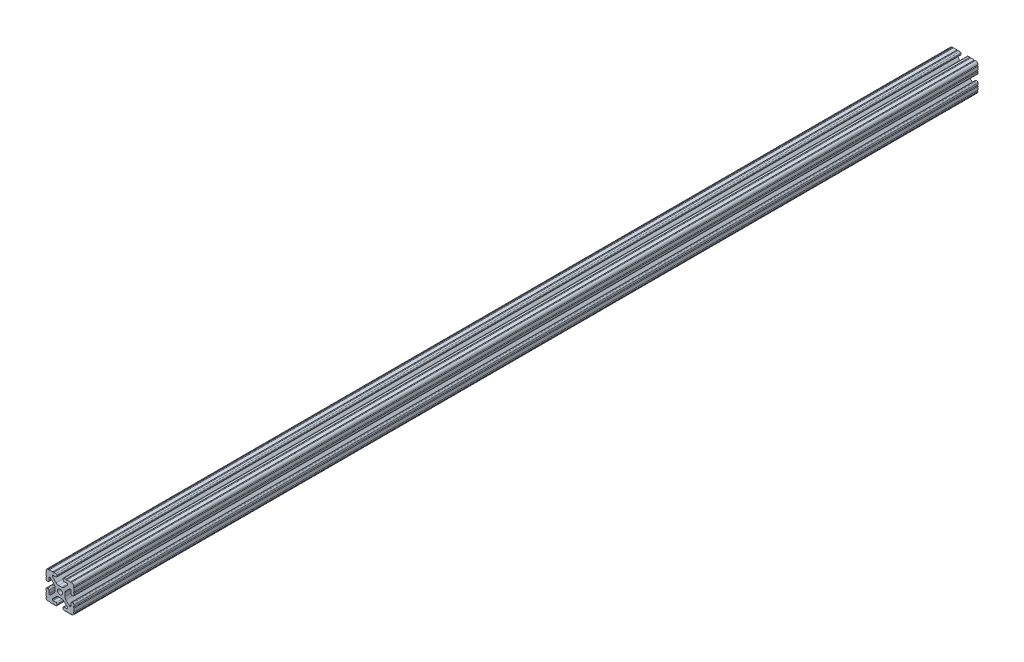
from build123d import *

# Parameters (mm, degrees)
SKETCH1_R      = 3.3274
EXTRUDE1_DEPTH = 1231.9


with BuildPart() as part:
    # Sketch1 → Extrude1 (new body)
    with BuildSketch(Plane.XY):
        with BuildLine():
            Line((-10.022898969, 12.91475973), (-5.252158105, 8.144007132))
            ThreePointArc((-5.252158105, 8.144007132), (-3.715177372, 7.117027388), (-1.902183975, 6.7564))
            Line((-1.902183975, 6.7564), (1.902183975, 6.7564))
            ThreePointArc((1.902183975, 6.7564), (3.715177372, 7.117027388), (5.252158105, 8.144007132))
            Line((5.252158105, 8.144007132), (10.022898969, 12.91475973))
            ThreePointArc((10.022898969, 12.91475973), (10.218362387, 13.207291992), (10.287, 13.552357131))
            Line((10.287, 13.552357131), (10.287, 14.0843))
            ThreePointArc((10.287, 14.0843), (10.022898185, 14.721898185), (9.3853, 14.986))
            Line((9.3853, 14.986), (5.617617549, 14.986))
            ThreePointArc((5.617617549, 14.986), (4.519044045, 15.441044045), (4.064, 16.539617549))
            Line((4.064, 16.539617549), (4.064, 17.496382451))
            ThreePointArc((4.064, 17.496382451), (4.519044045, 18.594955955), (5.617617549, 19.05))
            Line((5.617617549, 19.05), (7.974178704, 19.05))
            ThreePointArc((7.974178704, 19.05), (8.736178704, 18.288), (9.498178704, 19.05))
            Line((9.498178704, 19.05), (14.327719207, 19.05))
            ThreePointArc((14.327719207, 19.05), (15.087603123, 18.231251131), (15.847487039, 19.05))
            ThreePointArc((15.847487039, 19.05), (18.120176289, 18.120192083), (19.05, 15.847509295))
            ThreePointArc((19.05, 15.847509295), (18.231250992, 15.08762539), (19.05, 14.327741484))
            Line((19.05, 14.327741484), (19.05, 9.496091471))
            ThreePointArc((19.05, 9.496091471), (18.231250992, 8.736207565), (19.05, 7.97632366))
            Line((19.05, 7.97632366), (19.05, 5.617617549))
            ThreePointArc((19.05, 5.617617549), (18.594955955, 4.519044045), (17.496382451, 4.064))
            Line((17.496382451, 4.064), (16.539617549, 4.064))
            ThreePointArc((16.539617549, 4.064), (15.441044045, 4.519044045), (14.986, 5.617617549))
            Line((14.986, 5.617617549), (14.986, 9.385342516))
            ThreePointArc((14.986, 9.385342516), (14.721898185, 10.022940701), (14.0843, 10.287042516))
            Line((14.0843, 10.287042516), (13.516042086, 10.287042516))
            ThreePointArc((13.516042086, 10.287042516), (13.170975923, 10.218404478), (12.878443117, 10.022939917))
            Line((12.878443117, 10.022939917), (8.14758008, 5.292065243))
            ThreePointArc((8.14758008, 5.292065243), (7.117955879, 3.751120653), (6.7564, 1.933453584))
            Line((6.7564, 1.933453584), (6.7564, -1.933453584))
            ThreePointArc((6.7564, -1.933453584), (7.117955879, -3.751120653), (8.14758008, -5.292065243))
            Line((8.14758008, -5.292065243), (12.878443117, -10.022939917))
            ThreePointArc((12.878443117, -10.022939917), (13.170975923, -10.218404478), (13.516042086, -10.287042516))
            Line((13.516042086, -10.287042516), (14.0843, -10.287042516))
            ThreePointArc((14.0843, -10.287042516), (14.721898185, -10.022940701), (14.986, -9.385342516))
            Line((14.986, -9.385342516), (14.986, -5.617617549))
            ThreePointArc((14.986, -5.617617549), (15.441044045, -4.519044045), (16.539617549, -4.064))
            Line((16.539617549, -4.064), (17.496382451, -4.064))
            ThreePointArc((17.496382451, -4.064), (18.594955955, -4.519044045), (19.05, -5.617617549))
            Line((19.05, -5.617617549), (19.05, -7.976318491))
            ThreePointArc((19.05, -7.976318491), (18.231250992, -8.736202396), (19.05, -9.496086302))
            Line((19.05, -9.496086302), (19.05, -14.32774291))
            ThreePointArc((19.05, -14.32774291), (18.231250992, -15.087626816), (19.05, -15.847510721))
            ThreePointArc((19.05, -15.847510721), (18.120175716, -18.120192644), (15.847486868, -19.05))
            ThreePointArc((15.847486868, -19.05), (15.087602952, -18.231251131), (14.327719036, -19.05))
            Line((14.327719036, -19.05), (9.496062448, -19.05))
            ThreePointArc((9.496062448, -19.05), (8.736178532, -18.231251131), (7.976294616, -19.05))
            Line((7.976294616, -19.05), (5.617617549, -19.05))
            ThreePointArc((5.617617549, -19.05), (4.519044045, -18.594955955), (4.064, -17.496382451))
            Line((4.064, -17.496382451), (4.064, -16.539617549))
            ThreePointArc((4.064, -16.539617549), (4.519044045, -15.441044045), (5.617617549, -14.986))
            Line((5.617617549, -14.986), (9.3853, -14.986))
            ThreePointArc((9.3853, -14.986), (10.022898185, -14.721898185), (10.287, -14.0843))
            Line((10.287, -14.0843), (10.287, -13.552357131))
            ThreePointArc((10.287, -13.552357131), (10.218362387, -13.207291992), (10.022898969, -12.91475973))
            Line((10.022898969, -12.91475973), (5.252158105, -8.144007132))
            ThreePointArc((5.252158105, -8.144007132), (3.715177372, -7.117027388), (1.902183975, -6.7564))
            Line((1.902183975, -6.7564), (-1.902183975, -6.7564))
            ThreePointArc((-1.902183975, -6.7564), (-3.715177372, -7.117027388), (-5.252158105, -8.144007132))
            Line((-5.252158105, -8.144007132), (-10.022898969, -12.91475973))
            ThreePointArc((-10.022898969, -12.91475973), (-10.218362387, -13.207291992), (-10.287, -13.552357131))
            Line((-10.287, -13.552357131), (-10.287, -14.0843))
            ThreePointArc((-10.287, -14.0843), (-10.022898185, -14.721898185), (-9.3853, -14.986))
            Line((-9.3853, -14.986), (-5.617617549, -14.986))
            ThreePointArc((-5.617617549, -14.986), (-4.519044045, -15.441044045), (-4.064, -16.539617549))
            Line((-4.064, -16.539617549), (-4.064, -17.496382451))
            ThreePointArc((-4.064, -17.496382451), (-4.519044045, -18.594955955), (-5.617617549, -19.05))
            Line((-5.617617549, -19.05), (-7.976294616, -19.05))
            ThreePointArc((-7.976294616, -19.05), (-8.736178532, -18.231251131), (-9.496062448, -19.05))
            Line((-9.496062448, -19.05), (-14.327719036, -19.05))
            ThreePointArc((-14.327719036, -19.05), (-15.087602952, -18.231251131), (-15.847486868, -19.05))
            ThreePointArc((-15.847486868, -19.05), (-18.120175716, -18.120192644), (-19.05, -15.847510721))
            ThreePointArc((-19.05, -15.847510721), (-18.231250992, -15.087626816), (-19.05, -14.32774291))
            Line((-19.05, -14.32774291), (-19.05, -9.496086302))
            ThreePointArc((-19.05, -9.496086302), (-18.231250992, -8.736202396), (-19.05, -7.976318491))
            Line((-19.05, -7.976318491), (-19.05, -5.617617549))
            ThreePointArc((-19.05, -5.617617549), (-18.594955955, -4.519044045), (-17.496382451, -4.064))
            Line((-17.496382451, -4.064), (-16.539617549, -4.064))
            ThreePointArc((-16.539617549, -4.064), (-15.441044045, -4.519044045), (-14.986, -5.617617549))
            Line((-14.986, -5.617617549), (-14.986, -9.385342516))
            ThreePointArc((-14.986, -9.385342516), (-14.721898185, -10.022940701), (-14.0843, -10.287042516))
            Line((-14.0843, -10.287042516), (-13.516042086, -10.287042516))
            ThreePointArc((-13.516042086, -10.287042516), (-13.170975923, -10.218404478), (-12.878443117, -10.022939917))
            Line((-12.878443117, -10.022939917), (-8.14758008, -5.292065243))
            ThreePointArc((-8.14758008, -5.292065243), (-7.117955879, -3.751120653), (-6.7564, -1.933453584))
            Line((-6.7564, -1.933453584), (-6.7564, 1.933453584))
            ThreePointArc((-6.7564, 1.933453584), (-7.117955879, 3.751120653), (-8.14758008, 5.292065243))
            Line((-8.14758008, 5.292065243), (-12.878443117, 10.022939917))
            ThreePointArc((-12.878443117, 10.022939917), (-13.170975923, 10.218404478), (-13.516042086, 10.287042516))
            Line((-13.516042086, 10.287042516), (-14.0843, 10.287042516))
            ThreePointArc((-14.0843, 10.287042516), (-14.721898185, 10.022940701), (-14.986, 9.385342516))
            Line((-14.986, 9.385342516), (-14.986, 5.617617549))
            ThreePointArc((-14.986, 5.617617549), (-15.441044045, 4.519044045), (-16.539617549, 4.064))
            Line((-16.539617549, 4.064), (-17.496382451, 4.064))
            ThreePointArc((-17.496382451, 4.064), (-18.594955955, 4.519044045), (-19.05, 5.617617549))
            Line((-19.05, 5.617617549), (-19.05, 7.97632366))
            ThreePointArc((-19.05, 7.97632366), (-18.231250992, 8.736207565), (-19.05, 9.496091471))
            Line((-19.05, 9.496091471), (-19.05, 14.327741484))
            ThreePointArc((-19.05, 14.327741484), (-18.231250992, 15.08762539), (-19.05, 15.847509295))
            ThreePointArc((-19.05, 15.847509295), (-18.120176289, 18.120192083), (-15.847487039, 19.05))
            ThreePointArc((-15.847487039, 19.05), (-15.087603123, 18.231251131), (-14.327719207, 19.05))
            Line((-14.327719207, 19.05), (-9.498178704, 19.05))
            ThreePointArc((-9.498178704, 19.05), (-8.736178704, 18.288), (-7.974178704, 19.05))
            Line((-7.974178704, 19.05), (-5.617617549, 19.05))
            ThreePointArc((-5.617617549, 19.05), (-4.519044045, 18.594955955), (-4.064, 17.496382451))
            Line((-4.064, 17.496382451), (-4.064, 16.539617549))
            ThreePointArc((-4.064, 16.539617549), (-4.519044045, 15.441044045), (-5.617617549, 14.986))
            Line((-5.617617549, 14.986), (-9.3853, 14.986))
            ThreePointArc((-9.3853, 14.986), (-10.022898185, 14.721898185), (-10.287, 14.0843))
            Line((-10.287, 14.0843), (-10.287, 13.552357131))
            ThreePointArc((-10.287, 13.552357131), (-10.218362387, 13.207291992), (-10.022898969, 12.91475973))
        make_face()
        Circle(SKETCH1_R, mode=Mode.SUBTRACT)
    extrude(amount=-EXTRUDE1_DEPTH)


solid = part.part
